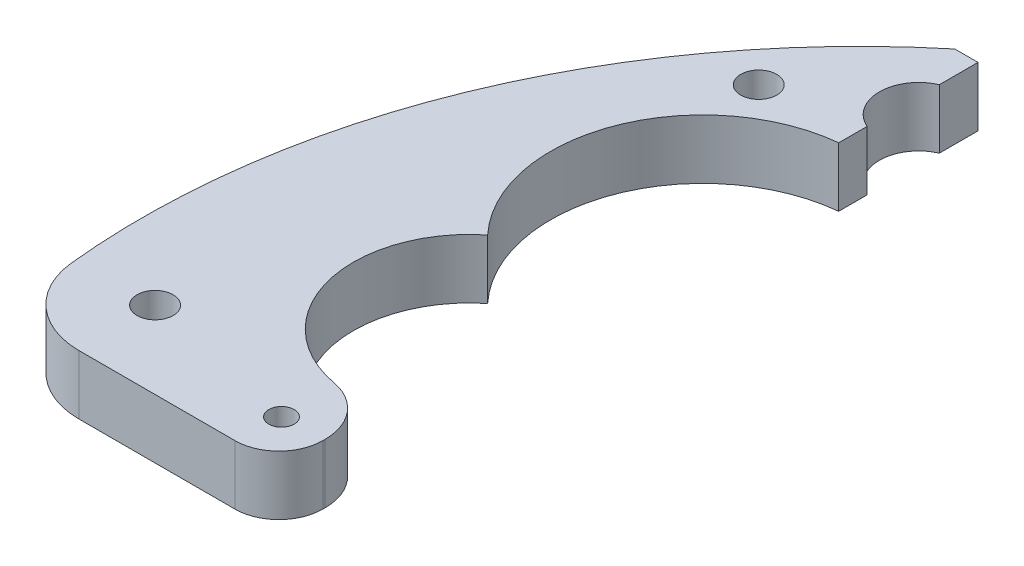
from build123d import *

# Parameters (mm, degrees)
BOSS_EXTRUDE1_DEPTH = 5.842
CUT_EXTRUDE1_DEPTH  = 77.930082101
CUT_EXTRUDE2_DEPTH  = 77.930082101
SKETCH8_R           = 11.43
CUT_EXTRUDE3_DEPTH  = 77.930082101
FILLET1_R           = 7.874
FILLET2_R           = 4.318
FILLET4_R           = 5.334
SKETCH9_R           = 1.774805699
CUT_EXTRUDE4_DEPTH  = 77.930082101
SKETCH10_R          = 1.25
CUT_EXTRUDE5_DEPTH  = 77.930082101
SKETCH11_R          = 1.778
CUT_EXTRUDE6_DEPTH  = 77.930082101


with BuildPart() as part:
    # Sketch1 → Boss-Extrude1 (new body)
    with BuildSketch(Plane(origin=(0, 0, 0), x_dir=(1, 0, 0), z_dir=(0, 1, 0))):
        with BuildLine():
            Line((30.379802604, 69.40499916), (32.665802604, 69.40499916))
            Line((32.665802604, 69.40499916), (32.665802604, 0.57099916))
            Line((32.665802604, 0.57099916), (6.249802604, 0.57099916))
            ThreePointArc((6.249802604, 0.57099916), (8.73869024, 38.344938918), (30.379802604, 69.40499916))
        make_face()
    extrude(amount=BOSS_EXTRUDE1_DEPTH)

    # Sketch2 → Cut-Extrude1 (cut, through all)
    with BuildSketch(Plane(origin=(0, 5.842, 0), x_dir=(1, 0, 0), z_dir=(0, 1, 0))):
        with BuildLine():
            Line((32.665802604, 65.59499916), (32.665802604, 58.48299916))
            ThreePointArc((32.665802604, 58.48299916), (30.320989866, 62.03899916), (32.665802604, 65.59499916))
        make_face()
    extrude(amount=-CUT_EXTRUDE1_DEPTH, mode=Mode.SUBTRACT)

    # Sketch7 → Cut-Extrude2 (cut, through all)
    with BuildSketch(Plane(origin=(0, 5.842, 0), x_dir=(1, 0, 0), z_dir=(0, 1, 0))):
        with BuildLine():
            Line((32.665802604, 55.68899916), (32.665802604, 25.872384999))
            ThreePointArc((32.665802604, 25.872384999), (19.203802604, 40.780692079), (32.665802604, 55.68899916))
        make_face()
    extrude(amount=-CUT_EXTRUDE2_DEPTH, mode=Mode.SUBTRACT)

    # Sketch8 → Cut-Extrude3 (cut, through all)
    with BuildSketch(Plane(origin=(0, 5.842, 0), x_dir=(1, 0, 0), z_dir=(0, 1, 0))):
        with Locations((30.379802604, 21.612613445)):
            Circle(SKETCH8_R)
    extrude(amount=-CUT_EXTRUDE3_DEPTH, mode=Mode.SUBTRACT)

    # Fillet1
    fillet1_edges = [part.edges().sort_by_distance(p)[0] for p in [
        (6.249802604, 2.921, -0.57099916),
    ]]
    fillet(fillet1_edges, radius=FILLET1_R)

    # Fillet2
    fillet2_edges = [part.edges().sort_by_distance(p)[0] for p in [
        (32.665802604, 2.921, -0.57099916),
    ]]
    fillet(fillet2_edges, radius=FILLET2_R)

    # Fillet4
    fillet4_edges = [part.edges().sort_by_distance(p)[0] for p in [
        (32.665802604, 2.921, -10.413546341),
    ]]
    fillet(fillet4_edges, radius=FILLET4_R)

    # Sketch9 → Cut-Extrude4 (cut, through all)
    with BuildSketch(Plane(origin=(0, 5.842, 0), x_dir=(1, 0, 0), z_dir=(0, 1, 0))):
        with Locations(Location((23.775802604, 56.70499916, 0), (0, 0, 270))):
            Circle(SKETCH9_R)
    extrude(amount=-CUT_EXTRUDE4_DEPTH, mode=Mode.SUBTRACT)

    # Sketch10 → Cut-Extrude5 (cut, through all)
    with BuildSketch(Plane(origin=(0, 5.842, 0), x_dir=(1, 0, 0), z_dir=(0, 1, 0))):
        with Locations(Location((28.601802604, 4.88899916, 0), (0, 0, 270))):
            Circle(SKETCH10_R)
    extrude(amount=-CUT_EXTRUDE5_DEPTH, mode=Mode.SUBTRACT)

    # Sketch11 → Cut-Extrude6 (cut, through all)
    with BuildSketch(Plane(origin=(0, 5.842, 0), x_dir=(1, 0, 0), z_dir=(0, 1, 0))):
        with Locations(Location((12.853802604, 8.19099916, 0), (0, 0, 270))):
            Circle(SKETCH11_R)
    extrude(amount=-CUT_EXTRUDE6_DEPTH, mode=Mode.SUBTRACT)


solid = part.part
